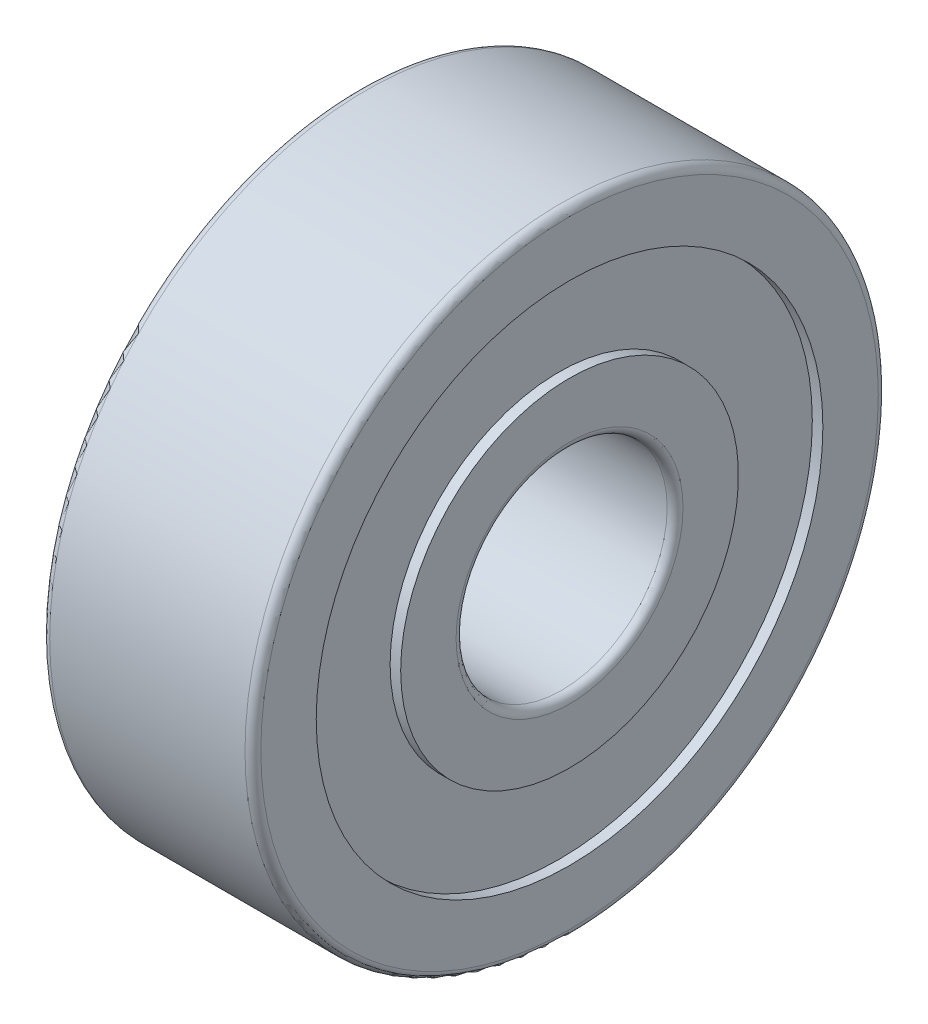
from build123d import *

# Parameters (mm, degrees)
FILLET_1_R = 0.3


with BuildPart() as part:
    # 草图1 → 旋转1 (revolve)
    with BuildSketch(Plane.XY, mode=Mode.PRIVATE) as revolve_1_sk:
        Polygon((-4, 12), (4, 12), (4, 9.6), (3.6, 9.6), (3.6, 6.4), (4, 6.4), (4, 4), (-4, 4), (-4, 6.4), (-3.6, 6.4), (-3.6, 9.6), (-4, 9.6), align=None)
    revolve(revolve_1_sk.sketch.rotate(Axis((0, 0, 0), (1, 0, 0)), 90), axis=Axis((0, 0, 0), (1, 0, 0)))

    # 圆角1
    fillet_1_edges = [part.edges().sort_by_distance(p)[0] for p in [
        (4, 0, -4),
        (-4, 0, -4),
        (-4, 0, -12),
        (4, 0, -12),
    ]]
    fillet(fillet_1_edges, radius=FILLET_1_R)


solid = part.part
